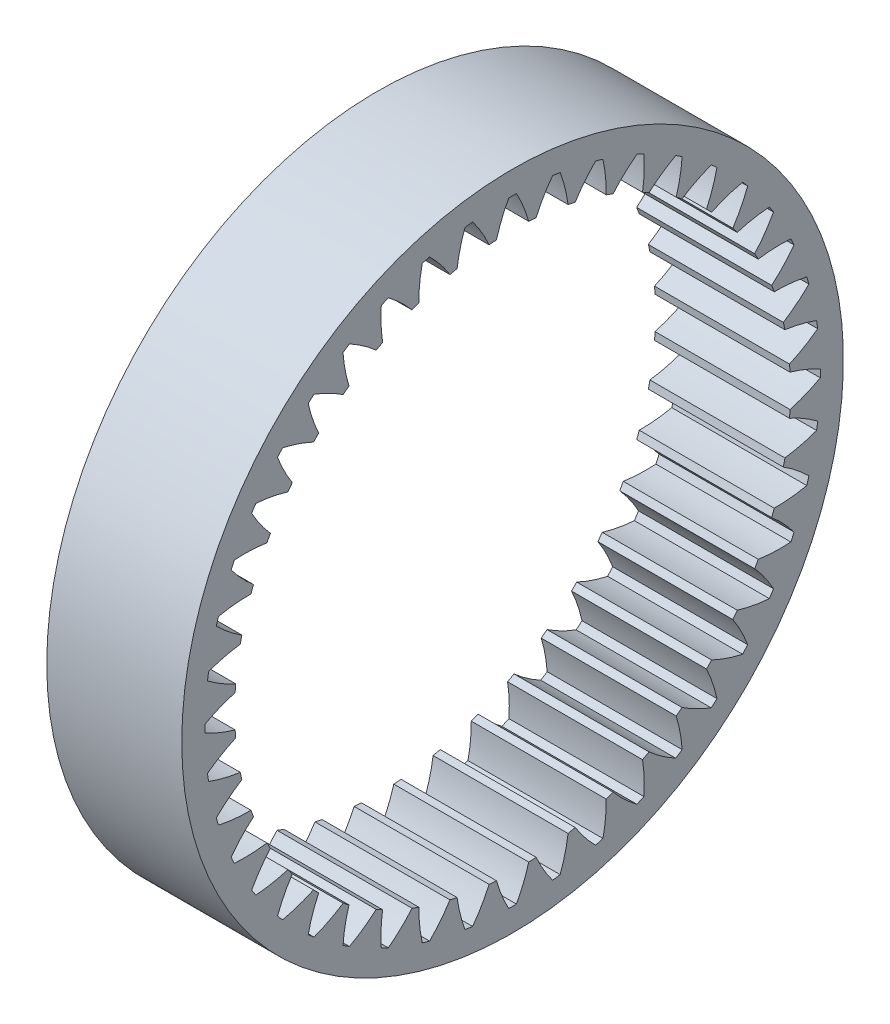
from build123d import *

# Parameters (mm, degrees)
BASPROSKE_W     = 5.1
BASPROSKE_H     = 2
TOOTHCUT_DEPTH  = 19.398641254
TEETHCUTS_COUNT = 44
TEETHCUTS_ANGLE = 351.818181818


with BuildPart() as part:
    # BasProSke → Base-Revolve (revolve)
    with BuildSketch(Plane(origin=(0, 0, 0), x_dir=(1, 0, 0), z_dir=(0, 1, 0)), mode=Mode.PRIVATE) as base_revolve_sk:
        with Locations((2.55, 11.5)):
            Rectangle(BASPROSKE_W, BASPROSKE_H)
    revolve(base_revolve_sk.sketch.rotate(Axis((-10, 0, 0), (1, 0, 0)), 180), axis=Axis((-10, 0, 0), (1, 0, 0)))

    # TooCutSke → ToothCut (cut, through all)
    with BuildSketch(Plane(origin=(0, 0, 0), x_dir=(0, 0, -1), z_dir=(1, 0, 0))):
        with BuildLine():
            ThreePointArc((0.617829312, 10.456363235), (0.415030024, 11.054321192), (0.145033431, 11.625095325))
            ThreePointArc((0.145033431, 11.625095325), (0, 11.626), (-0.145033431, 11.625095325))
            ThreePointArc((-0.145033431, 11.625095325), (-0.415030024, 11.054321192), (-0.617829312, 10.456363235))
            ThreePointArc((-0.617829312, 10.456363235), (0, 10.4746), (0.617829312, 10.456363235))
        make_face()
    toothcut = extrude(amount=TOOTHCUT_DEPTH, mode=Mode.SUBTRACT)

    # TeethCuts: ToothCut ×44 about axis
    teethcuts_axis = Axis((-10, 0, 0), (1, 0, 0))
    for i in range(1, TEETHCUTS_COUNT):
        add(toothcut.rotate(teethcuts_axis, i * TEETHCUTS_ANGLE / (TEETHCUTS_COUNT - 1)), mode=Mode.SUBTRACT)


solid = part.part
